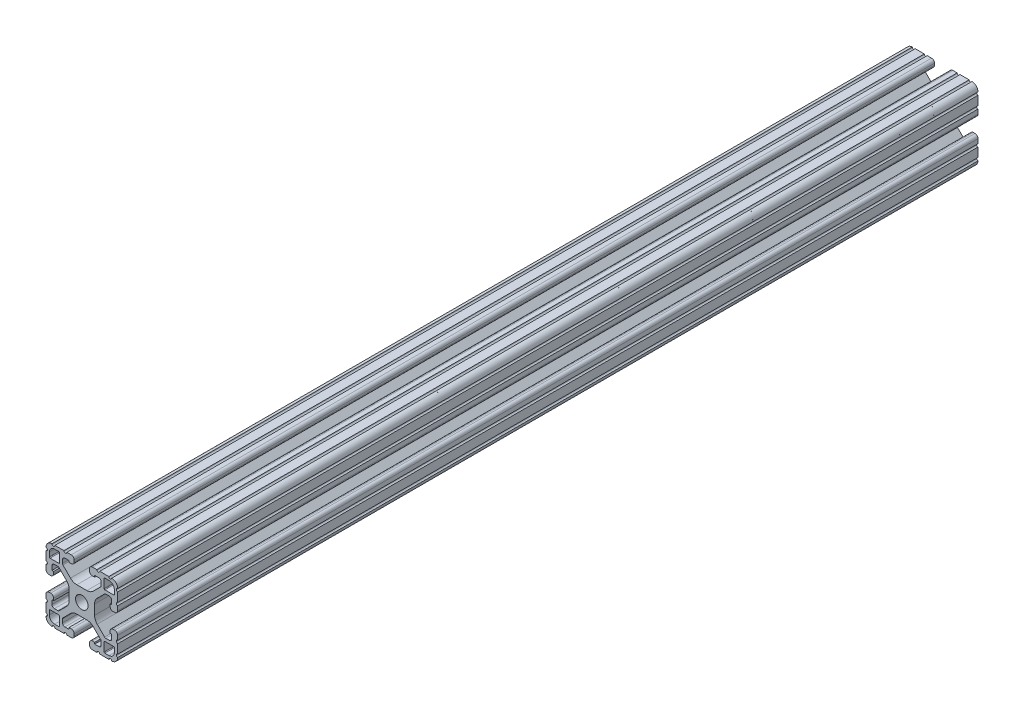
from build123d import *

# Parameters (mm, degrees)
SKETCH1_R      = 3.3274
EXTRUDE1_DEPTH = 457.2


with BuildPart() as part:
    # Sketch1 → Extrude1 (new body)
    with BuildSketch(Plane.XY):
        with BuildLine():
            Line((10.02670034, -12.151875049), (6.021451835, -8.147301292))
            ThreePointArc((6.021451835, -8.147301292), (4.48060392, -7.11788044), (2.663118988, -6.7564))
            Line((2.663118988, -6.7564), (-2.663118988, -6.7564))
            ThreePointArc((-2.663118988, -6.7564), (-4.48060392, -7.11788044), (-6.021451835, -8.147301292))
            Line((-6.021451835, -8.147301292), (-10.02670034, -12.151875049))
            ThreePointArc((-10.02670034, -12.151875049), (-10.219349756, -12.440155844), (-10.287, -12.78021916))
            Line((-10.287, -12.78021916), (-10.287, -14.55471092))
            ThreePointArc((-10.287, -14.55471092), (-9.915025612, -15.452736532), (-9.017, -15.82471092))
            Line((-9.017, -15.82471092), (-6.814144259, -15.82471092))
            Line((-6.814144259, -15.82471092), (-6.814144259, -14.986))
            Line((-6.814144259, -14.986), (-5.6388, -14.986))
            ThreePointArc((-5.6388, -14.986), (-4.525248241, -15.447248241), (-4.064, -16.5608))
            Line((-4.064, -16.5608), (-4.064, -17.4752))
            ThreePointArc((-4.064, -17.4752), (-4.525248241, -18.588751759), (-5.6388, -19.05))
            Line((-5.6388, -19.05), (-7.9756, -19.05))
            ThreePointArc((-7.9756, -19.05), (-8.7376, -18.288), (-9.4996, -19.05))
            Line((-9.4996, -19.05), (-14.3256, -19.05))
            ThreePointArc((-14.3256, -19.05), (-15.0876, -18.288), (-15.8496, -19.05))
            Line((-15.8496, -19.05), (-15.875, -19.05))
            ThreePointArc((-15.875, -19.05), (-18.12006403, -18.12006403), (-19.05, -15.875))
            Line((-19.05, -15.875), (-19.05, -15.8496))
            ThreePointArc((-19.05, -15.8496), (-18.288, -15.0876), (-19.05, -14.3256))
            Line((-19.05, -14.3256), (-19.05, -9.4996))
            ThreePointArc((-19.05, -9.4996), (-18.288, -8.7376), (-19.05, -7.9756))
            Line((-19.05, -7.9756), (-19.05, -5.6388))
            ThreePointArc((-19.05, -5.6388), (-18.588751759, -4.525248241), (-17.4752, -4.064))
            Line((-17.4752, -4.064), (-16.5608, -4.064))
            ThreePointArc((-16.5608, -4.064), (-15.447248241, -4.525248241), (-14.986, -5.6388))
            Line((-14.986, -5.6388), (-14.986, -6.750644259))
            Line((-14.986, -6.750644259), (-15.879033733, -6.750644259))
            Line((-15.879033733, -6.750644259), (-15.879033733, -8.919211783))
            ThreePointArc((-15.879033733, -8.919211783), (-15.507059345, -9.817237395), (-14.609033733, -10.189211783))
            Line((-14.609033733, -10.189211783), (-12.742784468, -10.189211783))
            ThreePointArc((-12.742784468, -10.189211783), (-12.402613491, -10.121555016), (-12.114219497, -9.928882664))
            Line((-12.114219497, -9.928882664), (-8.147867153, -5.963198517))
            ThreePointArc((-8.147867153, -5.963198517), (-7.118033561, -4.422154408), (-6.7564, -2.604299809))
            Line((-6.7564, -2.604299809), (-6.7564, 2.604299809))
            ThreePointArc((-6.7564, 2.604299809), (-7.118033561, 4.422154408), (-8.147867153, 5.963198517))
            Line((-8.147867153, 5.963198517), (-12.114219497, 9.928882664))
            ThreePointArc((-12.114219497, 9.928882664), (-12.402613491, 10.121555016), (-12.742784468, 10.189211783))
            Line((-12.742784468, 10.189211783), (-14.609033733, 10.189211783))
            ThreePointArc((-14.609033733, 10.189211783), (-15.507059345, 9.817237395), (-15.879033733, 8.919211783))
            Line((-15.879033733, 8.919211783), (-15.879033733, 6.750644259))
            Line((-15.879033733, 6.750644259), (-14.986, 6.750644259))
            Line((-14.986, 6.750644259), (-14.986, 5.6388))
            ThreePointArc((-14.986, 5.6388), (-15.447248241, 4.525248241), (-16.5608, 4.064))
            Line((-16.5608, 4.064), (-17.4752, 4.064))
            ThreePointArc((-17.4752, 4.064), (-18.588751759, 4.525248241), (-19.05, 5.6388))
            Line((-19.05, 5.6388), (-19.05, 7.9756))
            ThreePointArc((-19.05, 7.9756), (-18.288, 8.7376), (-19.05, 9.4996))
            Line((-19.05, 9.4996), (-19.05, 14.3256))
            ThreePointArc((-19.05, 14.3256), (-18.288, 15.0876), (-19.05, 15.8496))
            Line((-19.05, 15.8496), (-19.05, 15.875))
            ThreePointArc((-19.05, 15.875), (-18.12006403, 18.12006403), (-15.875, 19.05))
            Line((-15.875, 19.05), (-15.8496, 19.05))
            ThreePointArc((-15.8496, 19.05), (-15.0876, 18.288), (-14.3256, 19.05))
            Line((-14.3256, 19.05), (-9.4996, 19.05))
            ThreePointArc((-9.4996, 19.05), (-8.7376, 18.288), (-7.9756, 19.05))
            Line((-7.9756, 19.05), (-5.6388, 19.05))
            ThreePointArc((-5.6388, 19.05), (-4.525248241, 18.588751759), (-4.064, 17.4752))
            Line((-4.064, 17.4752), (-4.064, 16.5608))
            ThreePointArc((-4.064, 16.5608), (-4.525248241, 15.447248241), (-5.6388, 14.986))
            Line((-5.6388, 14.986), (-6.814144259, 14.986))
            Line((-6.814144259, 14.986), (-6.814144259, 15.82471092))
            Line((-6.814144259, 15.82471092), (-9.017, 15.82471092))
            ThreePointArc((-9.017, 15.82471092), (-9.915025612, 15.452736532), (-10.287, 14.55471092))
            Line((-10.287, 14.55471092), (-10.287, 12.78021916))
            ThreePointArc((-10.287, 12.78021916), (-10.219349756, 12.440155844), (-10.02670034, 12.151875049))
            Line((-10.02670034, 12.151875049), (-6.021451835, 8.147301292))
            ThreePointArc((-6.021451835, 8.147301292), (-4.48060392, 7.11788044), (-2.663118988, 6.7564))
            Line((-2.663118988, 6.7564), (2.663118988, 6.7564))
            ThreePointArc((2.663118988, 6.7564), (4.48060392, 7.11788044), (6.021451835, 8.147301292))
            Line((6.021451835, 8.147301292), (10.02670034, 12.151875049))
            ThreePointArc((10.02670034, 12.151875049), (10.219349756, 12.440155844), (10.287, 12.78021916))
            Line((10.287, 12.78021916), (10.287, 14.55471092))
            ThreePointArc((10.287, 14.55471092), (9.915025612, 15.452736532), (9.017, 15.82471092))
            Line((9.017, 15.82471092), (6.814144259, 15.82471092))
            Line((6.814144259, 15.82471092), (6.814144259, 14.986))
            Line((6.814144259, 14.986), (5.6388, 14.986))
            ThreePointArc((5.6388, 14.986), (4.525248241, 15.447248241), (4.064, 16.5608))
            Line((4.064, 16.5608), (4.064, 17.4752))
            ThreePointArc((4.064, 17.4752), (4.525248241, 18.588751759), (5.6388, 19.05))
            Line((5.6388, 19.05), (7.9756, 19.05))
            ThreePointArc((7.9756, 19.05), (8.7376, 18.288), (9.4996, 19.05))
            Line((9.4996, 19.05), (14.3256, 19.05))
            ThreePointArc((14.3256, 19.05), (15.0876, 18.288), (15.8496, 19.05))
            Line((15.8496, 19.05), (15.875, 19.05))
            ThreePointArc((15.875, 19.05), (18.12006403, 18.12006403), (19.05, 15.875))
            Line((19.05, 15.875), (19.05, 15.8496))
            ThreePointArc((19.05, 15.8496), (18.288, 15.0876), (19.05, 14.3256))
            Line((19.05, 14.3256), (19.05, 9.4996))
            ThreePointArc((19.05, 9.4996), (18.288, 8.7376), (19.05, 7.9756))
            Line((19.05, 7.9756), (19.05, 5.6388))
            ThreePointArc((19.05, 5.6388), (18.588751759, 4.525248241), (17.4752, 4.064))
            Line((17.4752, 4.064), (16.5608, 4.064))
            ThreePointArc((16.5608, 4.064), (15.447248241, 4.525248241), (14.986, 5.6388))
            Line((14.986, 5.6388), (14.986, 6.750644259))
            Line((14.986, 6.750644259), (15.879033733, 6.750644259))
            Line((15.879033733, 6.750644259), (15.879033733, 8.919211783))
            ThreePointArc((15.879033733, 8.919211783), (15.507059345, 9.817237395), (14.609033733, 10.189211783))
            Line((14.609033733, 10.189211783), (12.742784468, 10.189211783))
            ThreePointArc((12.742784468, 10.189211783), (12.402613491, 10.121555016), (12.114219497, 9.928882664))
            Line((12.114219497, 9.928882664), (8.147867153, 5.963198517))
            ThreePointArc((8.147867153, 5.963198517), (7.118033561, 4.422154408), (6.7564, 2.604299809))
            Line((6.7564, 2.604299809), (6.7564, -2.604299809))
            ThreePointArc((6.7564, -2.604299809), (7.118033561, -4.422154408), (8.147867153, -5.963198517))
            Line((8.147867153, -5.963198517), (12.114219497, -9.928882664))
            ThreePointArc((12.114219497, -9.928882664), (12.402613491, -10.121555016), (12.742784468, -10.189211783))
            Line((12.742784468, -10.189211783), (14.609033733, -10.189211783))
            ThreePointArc((14.609033733, -10.189211783), (15.507059345, -9.817237395), (15.879033733, -8.919211783))
            Line((15.879033733, -8.919211783), (15.879033733, -6.750644259))
            Line((15.879033733, -6.750644259), (14.986, -6.750644259))
            Line((14.986, -6.750644259), (14.986, -5.6388))
            ThreePointArc((14.986, -5.6388), (15.447248241, -4.525248241), (16.5608, -4.064))
            Line((16.5608, -4.064), (17.4752, -4.064))
            ThreePointArc((17.4752, -4.064), (18.588751759, -4.525248241), (19.05, -5.6388))
            Line((19.05, -5.6388), (19.05, -7.9756))
            ThreePointArc((19.05, -7.9756), (18.288, -8.7376), (19.05, -9.4996))
            Line((19.05, -9.4996), (19.05, -14.3256))
            ThreePointArc((19.05, -14.3256), (18.288, -15.0876), (19.05, -15.8496))
            Line((19.05, -15.8496), (19.05, -15.875))
            ThreePointArc((19.05, -15.875), (18.12006403, -18.12006403), (15.875, -19.05))
            Line((15.875, -19.05), (15.8496, -19.05))
            ThreePointArc((15.8496, -19.05), (15.0876, -18.288), (14.3256, -19.05))
            Line((14.3256, -19.05), (9.4996, -19.05))
            ThreePointArc((9.4996, -19.05), (8.7376, -18.288), (7.9756, -19.05))
            Line((7.9756, -19.05), (5.6388, -19.05))
            ThreePointArc((5.6388, -19.05), (4.525248241, -18.588751759), (4.064, -17.4752))
            Line((4.064, -17.4752), (4.064, -16.5608))
            ThreePointArc((4.064, -16.5608), (4.525248241, -15.447248241), (5.6388, -14.986))
            Line((5.6388, -14.986), (6.814144259, -14.986))
            Line((6.814144259, -14.986), (6.814144259, -15.82471092))
            Line((6.814144259, -15.82471092), (9.017, -15.82471092))
            ThreePointArc((9.017, -15.82471092), (9.915025612, -15.452736532), (10.287, -14.55471092))
            Line((10.287, -14.55471092), (10.287, -12.78021916))
            ThreePointArc((10.287, -12.78021916), (10.219349756, -12.440155844), (10.02670034, -12.151875049))
        make_face()
        Circle(SKETCH1_R, mode=Mode.SUBTRACT)
        with BuildLine():
            Line((16.891, -11.8618), (12.2428, -11.8618))
            ThreePointArc((12.2428, -11.8618), (11.973392316, -11.973392316), (11.8618, -12.2428))
            Line((11.8618, -12.2428), (11.8618, -16.891))
            ThreePointArc((11.8618, -16.891), (11.973392316, -17.160407684), (12.2428, -17.272))
            Line((12.2428, -17.272), (14.478, -17.272))
            ThreePointArc((14.478, -17.272), (16.453656347, -16.453656347), (17.272, -14.478))
            Line((17.272, -14.478), (17.272, -12.2428))
            ThreePointArc((17.272, -12.2428), (17.160407684, -11.973392316), (16.891, -11.8618))
        make_face(mode=Mode.SUBTRACT)
        with BuildLine():
            Line((17.272, 14.478), (17.272, 12.2428))
            ThreePointArc((17.272, 12.2428), (17.160407684, 11.973392316), (16.891, 11.8618))
            Line((16.891, 11.8618), (12.2428, 11.8618))
            ThreePointArc((12.2428, 11.8618), (11.973392316, 11.973392316), (11.8618, 12.2428))
            Line((11.8618, 12.2428), (11.8618, 16.891))
            ThreePointArc((11.8618, 16.891), (11.973392316, 17.160407684), (12.2428, 17.272))
            Line((12.2428, 17.272), (14.478, 17.272))
            ThreePointArc((14.478, 17.272), (16.453656347, 16.453656347), (17.272, 14.478))
        make_face(mode=Mode.SUBTRACT)
        with BuildLine():
            Line((-17.272, -14.478), (-17.272, -12.2428))
            ThreePointArc((-17.272, -12.2428), (-17.160407684, -11.973392316), (-16.891, -11.8618))
            Line((-16.891, -11.8618), (-12.2428, -11.8618))
            ThreePointArc((-12.2428, -11.8618), (-11.973392316, -11.973392316), (-11.8618, -12.2428))
            Line((-11.8618, -12.2428), (-11.8618, -16.891))
            ThreePointArc((-11.8618, -16.891), (-11.973392316, -17.160407684), (-12.2428, -17.272))
            Line((-12.2428, -17.272), (-14.478, -17.272))
            ThreePointArc((-14.478, -17.272), (-16.453656347, -16.453656347), (-17.272, -14.478))
        make_face(mode=Mode.SUBTRACT)
        with BuildLine():
            Line((-16.891, 11.8618), (-12.2428, 11.8618))
            ThreePointArc((-12.2428, 11.8618), (-11.973392316, 11.973392316), (-11.8618, 12.2428))
            Line((-11.8618, 12.2428), (-11.8618, 16.891))
            ThreePointArc((-11.8618, 16.891), (-11.973392316, 17.160407684), (-12.2428, 17.272))
            Line((-12.2428, 17.272), (-14.478, 17.272))
            ThreePointArc((-14.478, 17.272), (-16.453656347, 16.453656347), (-17.272, 14.478))
            Line((-17.272, 14.478), (-17.272, 12.2428))
            ThreePointArc((-17.272, 12.2428), (-17.160407684, 11.973392316), (-16.891, 11.8618))
        make_face(mode=Mode.SUBTRACT)
    extrude(amount=-EXTRUDE1_DEPTH)


solid = part.part
